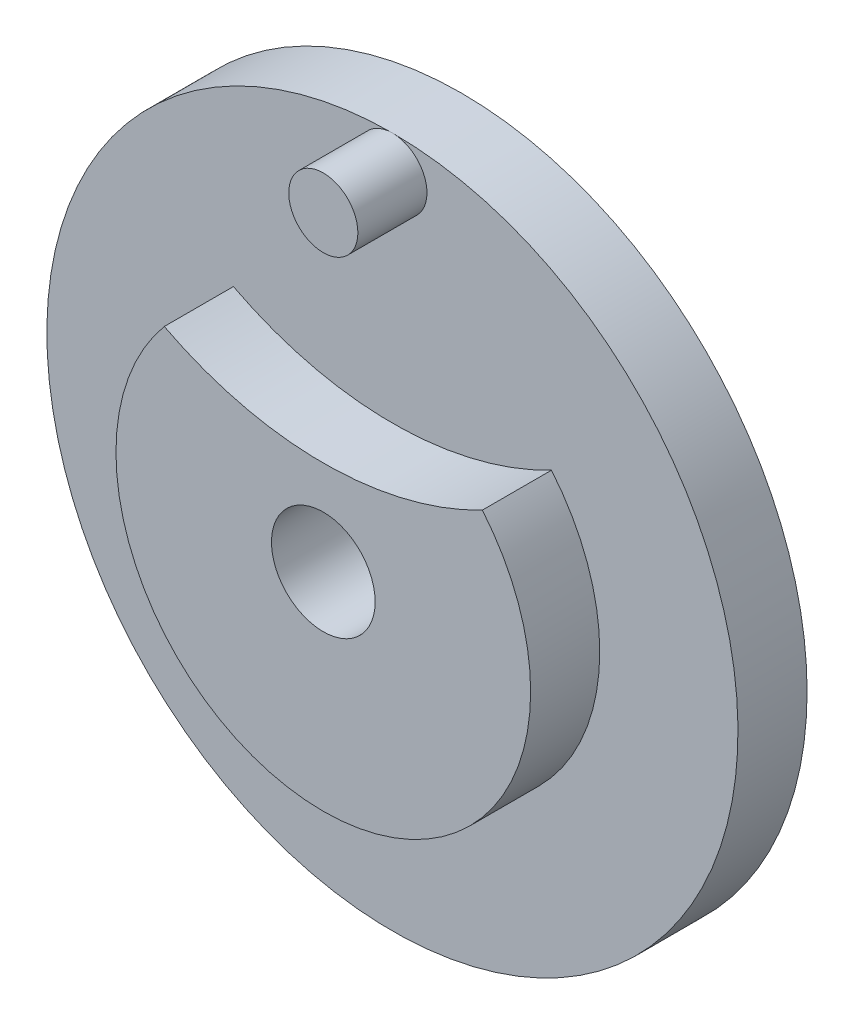
from build123d import *

# Parameters (mm, degrees)
SKETCH1_R           = 25
BOSS_EXTRUDE1_DEPTH = 2.5
SKETCH3_R           = 2.5
BOSS_EXTRUDE3_DEPTH = 7.5
SKETCH5_R           = 3.75
CUT_EXTRUDE1_DEPTH  = 37.742346142


with BuildPart() as part:
    # Sketch1 → Boss-Extrude1 (new, symmetric)
    with BuildSketch(Plane.XY):
        Circle(SKETCH1_R)
    extrude(amount=BOSS_EXTRUDE1_DEPTH, both=True)

    # Sketch3 → Boss-Extrude3 (add)
    with BuildSketch(Plane.XY):
        with Locations(Location((0, 22.5, 0), (0, 0, 90))):
            Circle(SKETCH3_R)
        with BuildLine():
            ThreePointArc((-11.505168712, 9.624504813), (0, -15), (11.505168712, 9.624504813))
            ThreePointArc((11.505168712, 9.624504813), (0, 6.8197992), (-11.505168712, 9.624504813))
        make_face()
    extrude(amount=BOSS_EXTRUDE3_DEPTH)

    # Sketch5 → Cut-Extrude1 (cut, through all)
    with BuildSketch(Plane.XY.offset(7.5)):
        Circle(SKETCH5_R)
    extrude(amount=-CUT_EXTRUDE1_DEPTH, mode=Mode.SUBTRACT)


solid = part.part
